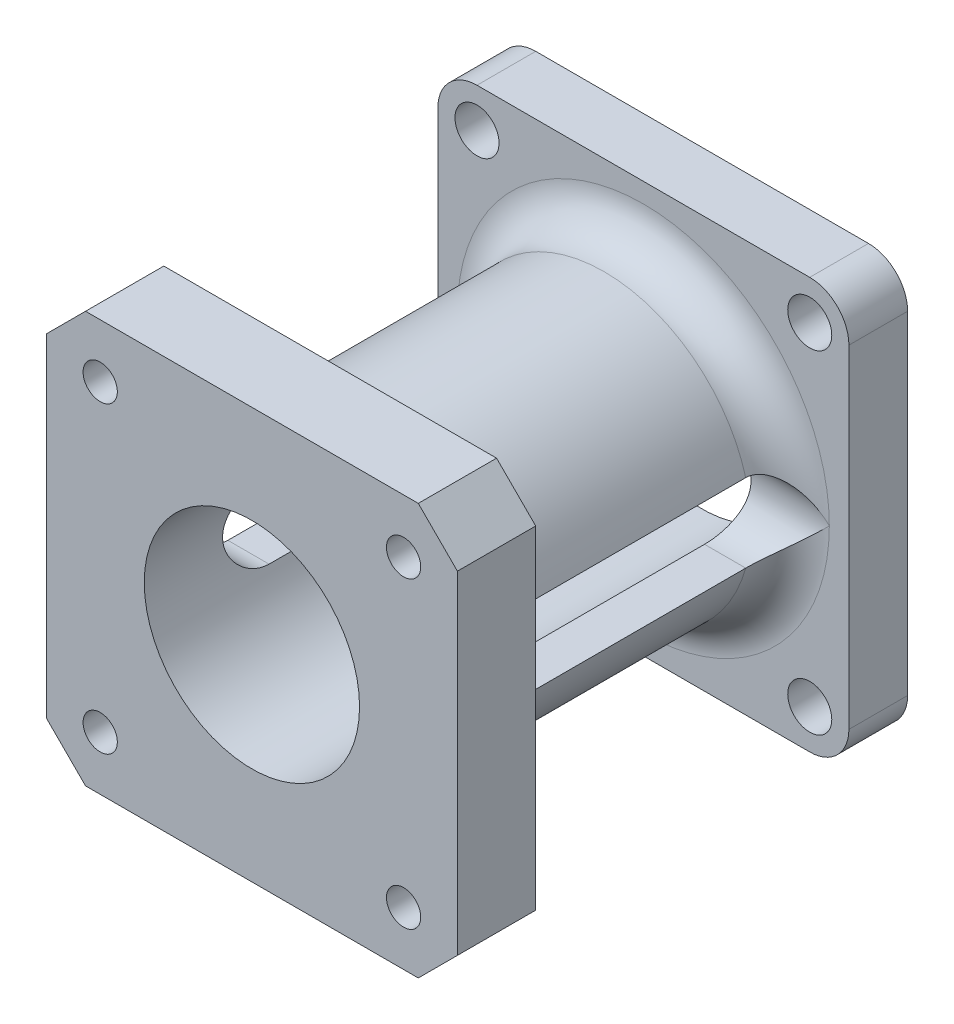
from build123d import *

# Parameters (mm, degrees)
CROQUIS1_W                 = 42
CROQUIS1_H                 = 42
SALIENTE_EXTRUIR1_DEPTH    = 6
CROQUIS2_R                 = 15
SALIENTE_EXTRUIR2_DEPTH    = 32
CROQUIS3_W                 = 42
CROQUIS3_H                 = 42
SALIENTE_EXTRUIR3_DEPTH    = 8
CROQUIS4_R                 = 11
CORTAR_EXTRUIR1_DEPTH      = 55.753995288
CROQUIS5_R                 = 1.75
CORTAR_EXTRUIR2_DEPTH      = 10
CHAFL_N1_SIZE              = 4
REDONDEO1_R                = 4
CROQUIS6_R                 = 2.25
CORTAR_EXTRUIR3_DEPTH      = 10
REDONDEO2_R                = 4
CORTAR_EXTRUIR4_DEPTH      = 55.753995288
CORTAR_EXTRUIR4_DEPTH_BACK = 55.753995288


with BuildPart() as part:
    # Croquis1 → Saliente-Extruir1 (new body)
    with BuildSketch(Plane.XY):
        Rectangle(CROQUIS1_W, CROQUIS1_H)
    extrude(amount=SALIENTE_EXTRUIR1_DEPTH)

    # Croquis2 → Saliente-Extruir2 (add)
    with BuildSketch(Plane.XY.offset(6)):
        Circle(CROQUIS2_R)
    extrude(amount=SALIENTE_EXTRUIR2_DEPTH)

    # Croquis3 → Saliente-Extruir3 (add)
    with BuildSketch(Plane.XY.offset(38)):
        Rectangle(CROQUIS3_W, CROQUIS3_H)
    extrude(amount=SALIENTE_EXTRUIR3_DEPTH)

    # Croquis4 → Cortar-Extruir1 (cut, through all)
    with BuildSketch(Plane.XY.offset(46)):
        Circle(CROQUIS4_R)
    extrude(amount=-CORTAR_EXTRUIR1_DEPTH, mode=Mode.SUBTRACT)

    # Croquis5 → Cortar-Extruir2 (cut)
    with BuildSketch(Plane.XY.offset(46)):
        with Locations((15.5, 15.5)):
            Circle(CROQUIS5_R)
        with Locations((-15.5, 15.5)):
            Circle(CROQUIS5_R)
        with Locations((-15.5, -15.5)):
            Circle(CROQUIS5_R)
        with Locations((15.5, -15.5)):
            Circle(CROQUIS5_R)
    extrude(amount=-CORTAR_EXTRUIR2_DEPTH, mode=Mode.SUBTRACT)

    # Chaflán1
    chafl_n1_edges = [part.edges().sort_by_distance(p)[0] for p in [
        (21, -21, 42),
        (21, 21, 42),
        (-21, 21, 42),
        (-21, -21, 42),
    ]]
    chamfer(chafl_n1_edges, length=CHAFL_N1_SIZE)

    # Redondeo1
    redondeo1_edges = [part.edges().sort_by_distance(p)[0] for p in [
        (-15, 0, 6),
        (-15, 0, 38),
    ]]
    fillet(redondeo1_edges, radius=REDONDEO1_R)

    # Croquis6 → Cortar-Extruir3 (cut)
    with BuildSketch(Plane(origin=(0, 0, 0), x_dir=(-1, 0, 0), z_dir=(0, 0, -1))):
        with Locations((17, 17)):
            Circle(CROQUIS6_R)
        with Locations((17, -17)):
            Circle(CROQUIS6_R)
        with Locations((-17, -17)):
            Circle(CROQUIS6_R)
        with Locations((-17, 17)):
            Circle(CROQUIS6_R)
    extrude(amount=-CORTAR_EXTRUIR3_DEPTH, mode=Mode.SUBTRACT)

    # Redondeo2
    redondeo2_edges = [part.edges().sort_by_distance(p)[0] for p in [
        (21, -21, 3),
        (-21, -21, 3),
        (-21, 21, 3),
        (21, 21, 3),
    ]]
    fillet(redondeo2_edges, radius=REDONDEO2_R)

    # Croquis7 → Cortar-Extruir4 (cut, two sides: drawn at the far end of the back side and taken through both)
    with BuildSketch(Plane(origin=(0, 0, 0), x_dir=(0, 0, -1), z_dir=(1, 0, 0)).offset(-CORTAR_EXTRUIR4_DEPTH_BACK)):
        with BuildLine():
            Line((-34, 4), (-10, 4))
            ThreePointArc((-10, 4), (-6, 0), (-10, -4))
            Line((-10, -4), (-34, -4))
            ThreePointArc((-34, -4), (-38, 0), (-34, 4))
        make_face()
    extrude(amount=CORTAR_EXTRUIR4_DEPTH + CORTAR_EXTRUIR4_DEPTH_BACK, mode=Mode.SUBTRACT)


solid = part.part
